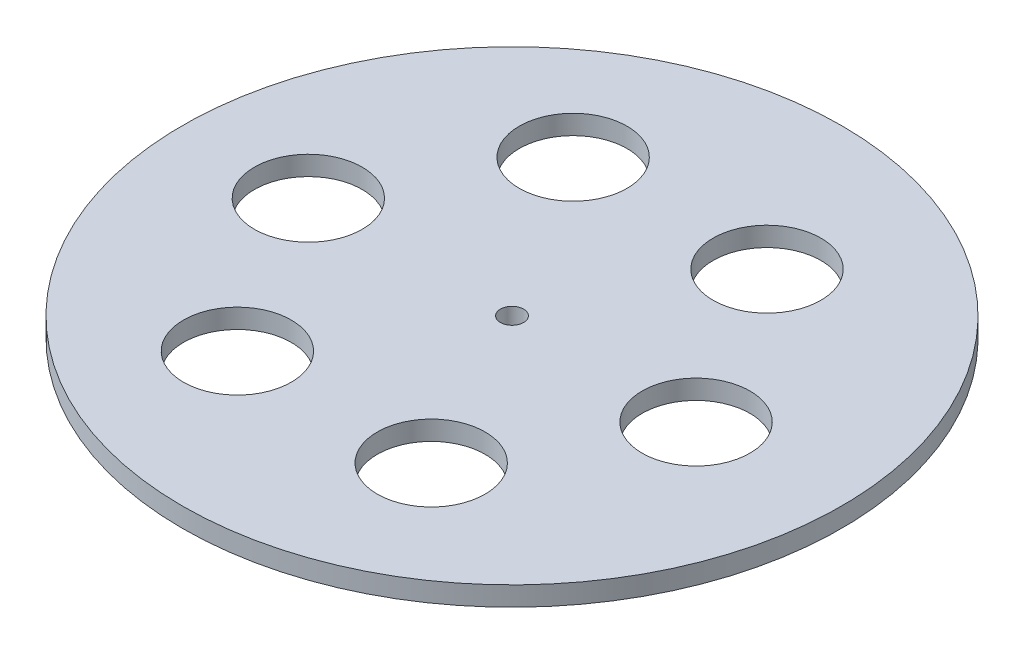
from build123d import *

# Parameters (mm, degrees)
SKETCH2_R           = 85
BOSS_EXTRUDE1_DEPTH = 5
SKETCH3_R           = 13.901120553
CUT_EXTRUDE1_DEPTH  = 121.312094155
SKETCH4_R           = 3
CUT_EXTRUDE2_DEPTH  = 10


with BuildPart() as part:
    # Sketch2 → Boss-Extrude1 (new body)
    with BuildSketch(Plane(origin=(0, 0, 0), x_dir=(1, 0, 0), z_dir=(0, 1, 0))):
        with Locations(Location((0, 0, 0), (0, 0, 270))):
            Circle(SKETCH2_R)
    extrude(amount=BOSS_EXTRUDE1_DEPTH)

    # Sketch3 → Cut-Extrude1 (cut, through all)
    with BuildSketch(Plane(origin=(0, 5, 0), x_dir=(1, 0, 0), z_dir=(0, 1, 0))):
        with Locations(Location((47.468904606, 0, 0), (0, 0, 270))):
            Circle(SKETCH3_R)
        with Locations(Location((22.468904606, -43.301270189, 0), (0, 0, 270))):
            Circle(SKETCH3_R)
        with Locations(Location((-27.531095394, -43.301270189, 0), (0, 0, 270))):
            Circle(SKETCH3_R)
        with Locations(Location((-52.531095394, 0, 0), (0, 0, 270))):
            Circle(SKETCH3_R)
        with Locations(Location((-27.531095394, 43.301270189, 0), (0, 0, 270))):
            Circle(SKETCH3_R)
        with Locations(Location((22.468904606, 43.301270189, 0), (0, 0, 270))):
            Circle(SKETCH3_R)
    extrude(amount=-CUT_EXTRUDE1_DEPTH, mode=Mode.SUBTRACT)

    # Sketch4 → Cut-Extrude2 (cut)
    with BuildSketch(Plane(origin=(0, 5, 0), x_dir=(1, 0, 0), z_dir=(0, 1, 0))):
        with Locations(Location((0, 0, 0), (0, 0, 270))):
            Circle(SKETCH4_R)
    extrude(amount=-CUT_EXTRUDE2_DEPTH, mode=Mode.SUBTRACT)


solid = part.part
